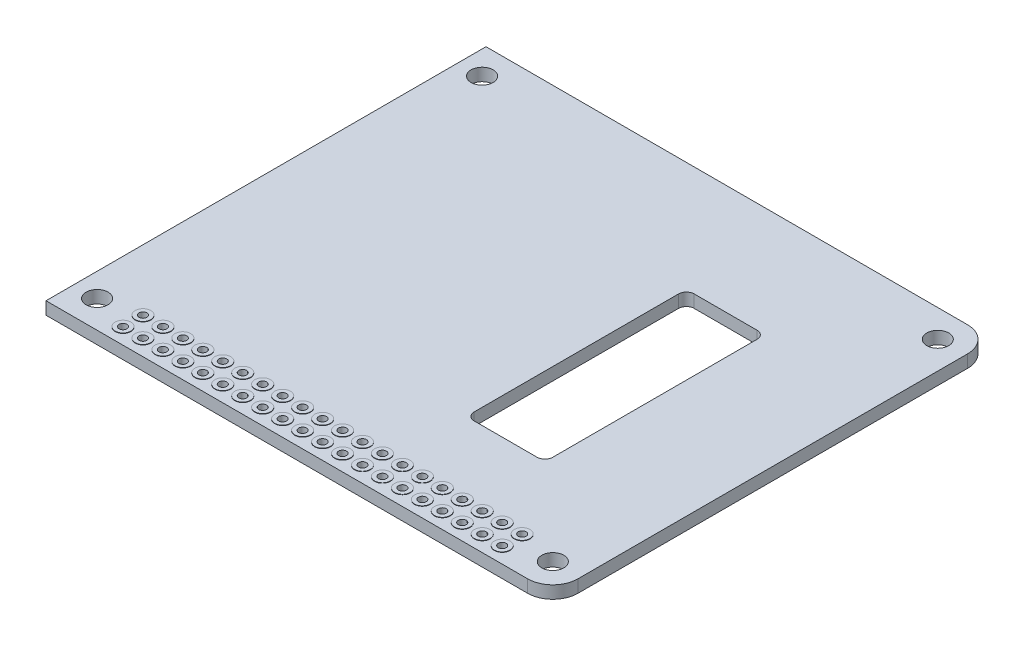
from build123d import *

# Parameters (mm, degrees)
SKETCH1_R            = 1.4
BOSS_EXTRUDE1_DEPTH  = 1.6
SKETCH2_R            = 0.5
CUT_EXTRUDE1_DEPTH   = 43.739004434
BOSS_EXTRUDE2_START  = 0.05
SKETCH3_R            = 1
SKETCH3_R_2          = 0.5
BOSS_EXTRUDE2_DEPTH  = 0.05
LPATTERN1_COUNT      = 20
LPATTERN1_PITCH      = 2.54
LPATTERN1_COUNT_DIR2 = 2
LPATTERN1_PITCH_DIR2 = 2.54
SKETCH4_W            = 1
SKETCH4_H            = 25
BOSS_EXTRUDE3_DEPTH  = 1


with BuildPart() as part:
    # Sketch1 → Boss-Extrude1 (new body)
    with BuildSketch(Plane(origin=(0, 0, 0), x_dir=(1, 0, 0), z_dir=(0, 1, 0))):
        with BuildLine():
            Line((-32.25, -28), (29.05, -28))
            ThreePointArc((29.05, -28), (31.3127417, -27.0627417), (32.25, -24.8))
            Line((32.25, -24.8), (32.25, 24.8))
            ThreePointArc((32.25, 24.8), (31.3127417, 27.0627417), (29.05, 28))
            Line((29.05, 28), (-32.25, 28))
            Line((-32.25, 28), (-32.25, -28))
        make_face()
        with Locations(Location((-29.25, -24.5, 0), (0, 0, 270))):
            Circle(SKETCH1_R, mode=Mode.SUBTRACT)
        with Locations(Location((-29.25, 24.5, 0), (0, 0, 270))):
            Circle(SKETCH1_R, mode=Mode.SUBTRACT)
        with Locations(Location((28.75, 24.5, 0), (0, 0, 270))):
            Circle(SKETCH1_R, mode=Mode.SUBTRACT)
        with Locations(Location((28.75, -24.5, 0), (0, 0, 270))):
            Circle(SKETCH1_R, mode=Mode.SUBTRACT)
        with BuildLine():
            Line((16.25, -14), (8.25, -14))
            ThreePointArc((8.25, -14), (7.542893219, -13.707106781), (7.25, -13))
            Line((7.25, -13), (7.25, 13))
            ThreePointArc((7.25, 13), (7.542893219, 13.707106781), (8.25, 14))
            Line((8.25, 14), (16.25, 14))
            ThreePointArc((16.25, 14), (16.957106781, 13.707106781), (17.25, 13))
            Line((17.25, 13), (17.25, -13))
            ThreePointArc((17.25, -13), (16.957106781, -13.707106781), (16.25, -14))
        make_face(mode=Mode.SUBTRACT)
    extrude(amount=BOSS_EXTRUDE1_DEPTH)

    # Sketch2 → Cut-Extrude1 (cut, through all)
    with BuildSketch(Plane(origin=(0, 1.6, 0), x_dir=(1, 0, 0), z_dir=(0, 1, 0))):
        with Locations(Location((-24.45, -26, 0), (0, 0, 270))):
            Circle(SKETCH2_R)
    cut_extrude1 = extrude(amount=-CUT_EXTRUDE1_DEPTH, mode=Mode.SUBTRACT)

    # Sketch3 → Boss-Extrude2 (add)
    with BuildSketch(Plane(origin=(0, 1.6, 0), x_dir=(1, 0, 0), z_dir=(0, 1, 0)).offset(BOSS_EXTRUDE2_START)):
        with Locations(Location((-24.45, -26, 0), (0, 0, 90))):
            Circle(SKETCH3_R)
        with Locations(Location((-24.45, -26, 0), (0, 0, 270))):
            Circle(SKETCH3_R_2, mode=Mode.SUBTRACT)
    boss_extrude2 = extrude(amount=-BOSS_EXTRUDE2_DEPTH)

    # LPattern1: Cut-Extrude1, Boss-Extrude2 20 × 2
    with Locations(*[(i * LPATTERN1_PITCH, 0, -j * LPATTERN1_PITCH_DIR2) for i in range(LPATTERN1_COUNT) for j in range(LPATTERN1_COUNT_DIR2) if (i, j) != (0, 0)]):
        add(cut_extrude1, mode=Mode.SUBTRACT)
        add(boss_extrude2)

    # Sketch4 → Boss-Extrude3 (add)
    with BuildSketch(Plane.XZ):
        with Locations((-5.75, 0)):
            Rectangle(SKETCH4_W, SKETCH4_H)
    extrude(amount=BOSS_EXTRUDE3_DEPTH)


solid = part.part
